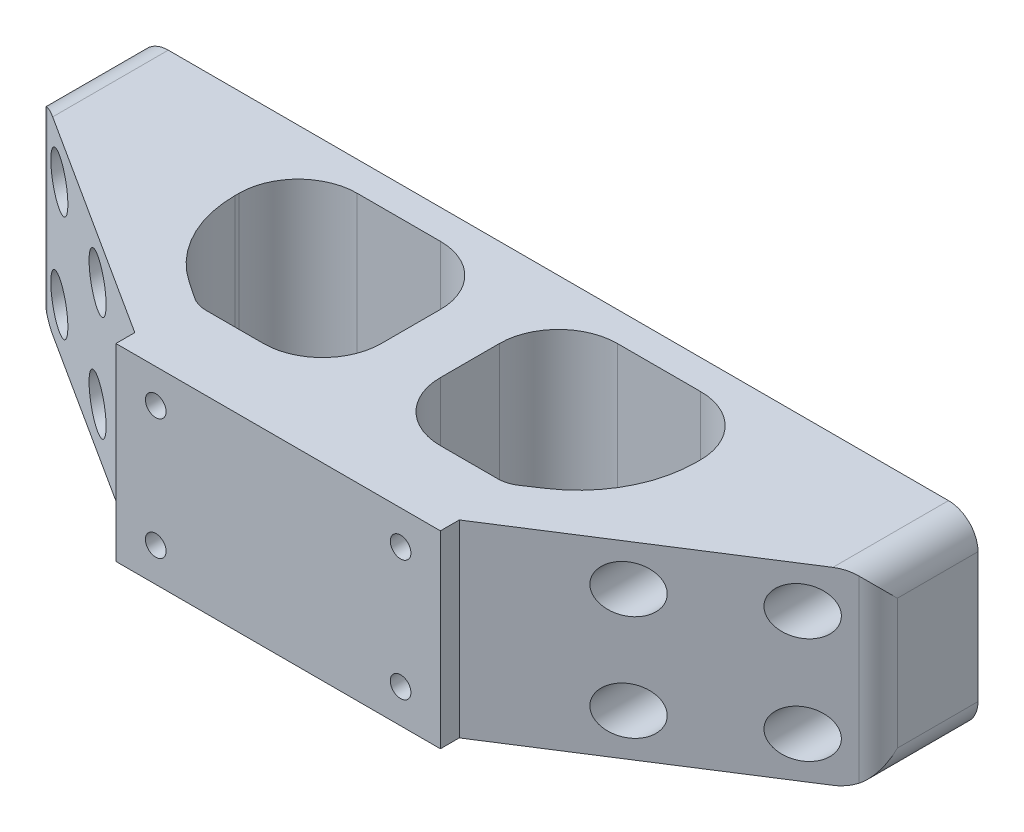
from build123d import *

# Parameters (mm, degrees)
BOSS_EXTRUDE1_DEPTH = 32
FILLET16_R          = 10
FILLET18_R          = 10
FILLET22_R          = 3
FILLET23_R          = 3
FILLET30_R          = 3
FILLET31_R          = 3
FILLET34_R          = 10
FILLET35_R          = 5
SKETCH10_R          = 169.610850048
CUT_EXTRUDE6_DEPTH  = 100.305164141
FILLET37_R          = 10
FILLET38_R          = 20
FILLET39_R          = 10
FILLET40_R          = 20
SKETCH12_W          = 10
SKETCH12_H          = 29.166193857
CUT_EXTRUDE8_DEPTH  = 106.854927259
SKETCH9_R           = 1.75
CUT_EXTRUDE9_DEPTH  = 12.5
FILLET41_R          = 10
FILLET42_R          = 5
SKETCH13_R          = 2.375
CUT_EXTRUDE10_DEPTH = 100.305164141
SKETCH13_3_R        = 4
CUT_EXTRUDE11_DEPTH = 35
FILLET44_R          = 5
FILLET45_R          = 5
BOSS_EXTRUDE2_DEPTH = 32


with BuildPart() as part:
    # Sketch1 → Boss-Extrude1 (new body)
    with BuildSketch(Plane(origin=(0, 0, 0), x_dir=(1, 0, 0), z_dir=(0, 1, 0))):
        with BuildLine():
            Line((22.5, -60), (81.125, -22.5))
            Line((81.125, -22.5), (81.125, 0))
            Line((81.125, 0), (75.125, 0))
            ThreePointArc((75.125, 0), (62.625, -12.5), (50.125, 0))
            Line((50.125, 0), (44.125, 0))
            Line((44.125, 0), (44.125, -12.5))
            Line((44.125, -12.5), (0, -12.5))
            Line((0, -12.5), (0, -60))
            Line((0, -60), (22.5, -60))
        make_face()
        Polygon((26.225, -47.5), (5, -47.5), (5, -17.5), (39.125, -17.5), (39.125, -38.880846325), align=None, mode=Mode.SUBTRACT)
    boss_extrude1 = extrude(amount=BOSS_EXTRUDE1_DEPTH)

    # Mirror1: Boss-Extrude1 across plane
    add(boss_extrude1.mirror(Plane(origin=(0, 32, 0), x_dir=(0, 0, 1), z_dir=(-1, 0, 0))))

    # Fillet16
    fillet16_edges = [part.edges().sort_by_distance(p)[0] for p in [
        (5, 16, 17.5),
    ]]
    fillet(fillet16_edges, radius=FILLET16_R)

    # Fillet18
    fillet18_edges = [part.edges().sort_by_distance(p)[0] for p in [
        (-5, 16, 17.5),
    ]]
    fillet(fillet18_edges, radius=FILLET18_R)

    # Fillet22
    fillet22_edges = [part.edges().sort_by_distance(p)[0] for p in [
        (44.125, 16, 12.5),
    ]]
    fillet(fillet22_edges, radius=FILLET22_R)

    # Fillet23
    fillet23_edges = [part.edges().sort_by_distance(p)[0] for p in [
        (-44.125, 16, 12.5),
    ]]
    fillet(fillet23_edges, radius=FILLET23_R)

    # Fillet30
    fillet30_edges = [part.edges().sort_by_distance(p)[0] for p in [
        (81.125, 16, 22.5),
    ]]
    fillet(fillet30_edges, radius=FILLET30_R)

    # Fillet31
    fillet31_edges = [part.edges().sort_by_distance(p)[0] for p in [
        (-81.125, 16, 22.5),
    ]]
    fillet(fillet31_edges, radius=FILLET31_R)

    # Fillet34
    fillet34_edges = [part.edges().sort_by_distance(p)[0] for p in [
        (5, 16, 47.5),
    ]]
    fillet(fillet34_edges, radius=FILLET34_R)

    # Fillet35
    fillet35_edges = [part.edges().sort_by_distance(p)[0] for p in [
        (-26.225, 16, 47.5),
    ]]
    fillet(fillet35_edges, radius=FILLET35_R)

    # Sketch10 → Cut-Extrude6 (cut, through all)
    with BuildSketch(Plane(origin=(0, 0, 12.5), x_dir=(-1, 0, 0), z_dir=(0, 0, -1))):
        Circle(SKETCH10_R)
    extrude(amount=CUT_EXTRUDE6_DEPTH, mode=Mode.SUBTRACT)

    # Fillet37
    fillet37_edges = [part.edges().sort_by_distance(p)[0] for p in [
        (39.125, 16, 17.5),
    ]]
    fillet(fillet37_edges, radius=FILLET37_R)

    # Fillet38
    fillet38_edges = [part.edges().sort_by_distance(p)[0] for p in [
        (39.125, 16, 38.880846325),
    ]]
    fillet(fillet38_edges, radius=FILLET38_R)

    # Fillet39
    fillet39_edges = [part.edges().sort_by_distance(p)[0] for p in [
        (-39.125, 16, 17.5),
    ]]
    fillet(fillet39_edges, radius=FILLET39_R)

    # Fillet40
    fillet40_edges = [part.edges().sort_by_distance(p)[0] for p in [
        (-39.125, 16, 38.880846325),
    ]]
    fillet(fillet40_edges, radius=FILLET40_R)

    # Sketch12 → Cut-Extrude8 (cut, through all)
    with BuildSketch(Plane(origin=(0, 0, 0), x_dir=(-1, 0, 0), z_dir=(0, -1, 0))):
        with Locations((-76.125, -27.083096929)):
            Rectangle(SKETCH12_W, SKETCH12_H)
    cut_extrude8 = extrude(amount=-CUT_EXTRUDE8_DEPTH, mode=Mode.SUBTRACT)

    # Sketch9 → Cut-Extrude9 (cut)
    with BuildSketch(Plane.XY.offset(60)):
        with Locations((-20.75, 5.75)):
            Circle(SKETCH9_R)
        with Locations((-20.75, 26.25)):
            Circle(SKETCH9_R)
    cut_extrude9 = extrude(amount=-CUT_EXTRUDE9_DEPTH, mode=Mode.SUBTRACT)

    # Fillet41
    fillet41_edges = [part.edges().sort_by_distance(p)[0] for p in [
        (-5, 16, 47.5),
    ]]
    fillet(fillet41_edges, radius=FILLET41_R)

    # Fillet42
    fillet42_edges = [part.edges().sort_by_distance(p)[0] for p in [
        (26.225, 16, 47.5),
    ]]
    fillet(fillet42_edges, radius=FILLET42_R)

    # Mirror5: Cut-Extrude9 across plane
    add(cut_extrude9.mirror(Plane(origin=(0, 0, 0), x_dir=(0, 0, 1), z_dir=(1, 0, 0))), mode=Mode.SUBTRACT)

    # Sketch13 → Cut-Extrude10 (cut, symmetric)
    with BuildSketch(Plane.XY.offset(60)):
        with Locations((45, 7.15)):
            Circle(SKETCH13_R)
        with Locations((45, 25)):
            Circle(SKETCH13_R)
        with Locations((63, 25)):
            Circle(SKETCH13_R)
        with Locations((63, 7)):
            Circle(SKETCH13_R)
    cut_extrude10 = extrude(amount=CUT_EXTRUDE10_DEPTH, both=True, mode=Mode.SUBTRACT)

    # Sketch13<3> → Cut-Extrude11 (cut)
    with BuildSketch(Plane.XY.offset(60)):
        with Locations((45, 7.15)):
            Circle(SKETCH13_3_R)
        with Locations((45, 25)):
            Circle(SKETCH13_3_R)
        with Locations((63, 25)):
            Circle(SKETCH13_3_R)
        with Locations((63, 7)):
            Circle(SKETCH13_3_R)
    cut_extrude11 = extrude(amount=-CUT_EXTRUDE11_DEPTH, mode=Mode.SUBTRACT)

    # Mirror6: Cut-Extrude10, Cut-Extrude11 across plane
    add(cut_extrude10.mirror(Plane(origin=(0, 0, 0), x_dir=(0, 0, 1), z_dir=(1, 0, 0))), mode=Mode.SUBTRACT)
    add(cut_extrude11.mirror(Plane(origin=(0, 0, 0), x_dir=(0, 0, 1), z_dir=(1, 0, 0))), mode=Mode.SUBTRACT)

    # Fillet44
    fillet44_edges = [part.edges().sort_by_distance(p)[0] for p in [
        (71.125, 16, 28.896588486),
        (71.125, 32, 20.698294243),
        (71.125, 0, 20.698294243),
    ]]
    fillet(fillet44_edges, radius=FILLET44_R)

    # Mirror7: Cut-Extrude8 across plane
    add(cut_extrude8.mirror(Plane(origin=(0, 0, 0), x_dir=(0, 0, 1), z_dir=(1, 0, 0))), mode=Mode.SUBTRACT)

    # Fillet45
    fillet45_edges = [part.edges().sort_by_distance(p)[0] for p in [
        (-71.125, 16, 28.896588486),
        (-71.125, 32, 20.698294243),
        (-71.125, 0, 20.698294243),
    ]]
    fillet(fillet45_edges, radius=FILLET45_R)

    # Sketch14 → Boss-Extrude2 (add)
    with BuildSketch(Plane.XZ):
        Polygon((-27.5, 56.801705757), (-22.5, 60), (-27.5, 60), align=None)
    boss_extrude2 = extrude(amount=-BOSS_EXTRUDE2_DEPTH)

    # Mirror8: Boss-Extrude2 across plane
    add(boss_extrude2.mirror(Plane(origin=(0, 0, 0), x_dir=(0, 0, 1), z_dir=(1, 0, 0))))


solid = part.part
